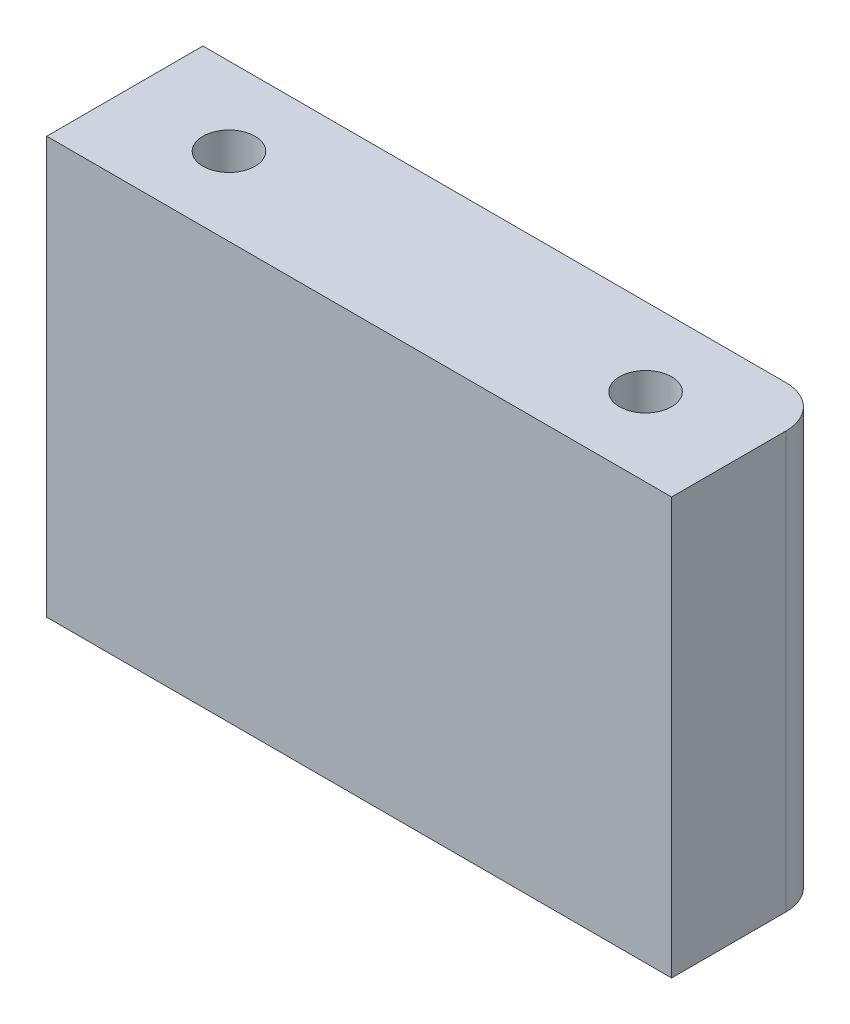
from build123d import *

# Parameters (mm, degrees)
SKETCH1_W           = 38.1
SKETCH1_H           = 25.4
BOSS_EXTRUDE1_DEPTH = 9.525
SKETCH2_R           = 1.5875
CUT_EXTRUDE1_DEPTH  = 47.770670564
FILLET1_R           = 2.54


with BuildPart() as part:
    # Sketch1 → Boss-Extrude1 (new body)
    with BuildSketch(Plane.XY):
        with Locations((19.05, 12.7)):
            Rectangle(SKETCH1_W, SKETCH1_H)
    extrude(amount=BOSS_EXTRUDE1_DEPTH)

    # Sketch2 → Cut-Extrude1 (cut, through all)
    with BuildSketch(Plane.XZ):
        with Locations(Location((6.35, 4.7625, 0), (0, 0, 270))):
            Circle(SKETCH2_R)
        with Locations(Location((31.75, 4.7625, 0), (0, 0, 90))):
            Circle(SKETCH2_R)
    extrude(amount=-CUT_EXTRUDE1_DEPTH, mode=Mode.SUBTRACT)

    # Fillet1
    fillet1_edges = [part.edges().sort_by_distance(p)[0] for p in [
        (38.1, 12.7, 0),
    ]]
    fillet(fillet1_edges, radius=FILLET1_R)


solid = part.part
